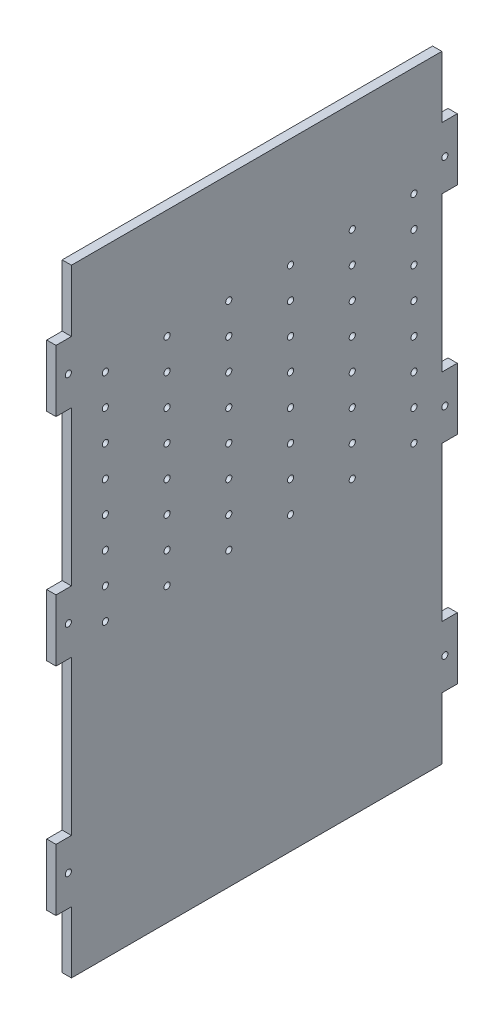
from build123d import *

# Parameters (mm, degrees)
SKETCH1_R           = 1
BOSS_EXTRUDE1_DEPTH = 3


with BuildPart() as part:
    # Sketch1 → Boss-Extrude1 (new body)
    with BuildSketch(Plane.YZ):
        Polygon((-80, 60), (-80, 65), (-60, 65), (-60, 60), (-10, 60), (-10, 65), (10, 65), (10, 60), (60, 60), (60, 65), (80, 65), (80, 60), (100, 60), (100, -60), (80, -60), (80, -65), (60, -65), (60, -60), (10, -60), (10, -65), (-10, -65), (-10, -60), (-60, -60), (-60, -65), (-80, -65), (-80, -60), (-100, -60), (-100, 60), align=None)
        with Locations(Location((-5.445919919, 49.018671667, 0), (0, 0, 270))):
            Circle(SKETCH1_R, mode=Mode.SUBTRACT)
        with Locations(Location((4.554080081, 49.018671667, 0), (0, 0, 270))):
            Circle(SKETCH1_R, mode=Mode.SUBTRACT)
        with Locations(Location((14.554080081, 49.018671667, 0), (0, 0, 270))):
            Circle(SKETCH1_R, mode=Mode.SUBTRACT)
        with Locations(Location((24.554080081, 49.018671667, 0), (0, 0, 270))):
            Circle(SKETCH1_R, mode=Mode.SUBTRACT)
        with Locations(Location((34.554080081, 49.018671667, 0), (0, 0, 270))):
            Circle(SKETCH1_R, mode=Mode.SUBTRACT)
        with Locations(Location((44.554080081, 49.018671667, 0), (0, 0, 270))):
            Circle(SKETCH1_R, mode=Mode.SUBTRACT)
        with Locations(Location((54.554080081, 49.018671667, 0), (0, 0, 270))):
            Circle(SKETCH1_R, mode=Mode.SUBTRACT)
        with Locations(Location((64.554080081, 49.018671667, 0), (0, 0, 270))):
            Circle(SKETCH1_R, mode=Mode.SUBTRACT)
        with Locations(Location((-5.445919919, 29.018671667, 0), (0, 0, 270))):
            Circle(SKETCH1_R, mode=Mode.SUBTRACT)
        with Locations(Location((4.554080081, 29.018671667, 0), (0, 0, 270))):
            Circle(SKETCH1_R, mode=Mode.SUBTRACT)
        with Locations(Location((14.554080081, 29.018671667, 0), (0, 0, 270))):
            Circle(SKETCH1_R, mode=Mode.SUBTRACT)
        with Locations(Location((24.554080081, 29.018671667, 0), (0, 0, 270))):
            Circle(SKETCH1_R, mode=Mode.SUBTRACT)
        with Locations(Location((34.554080081, 29.018671667, 0), (0, 0, 270))):
            Circle(SKETCH1_R, mode=Mode.SUBTRACT)
        with Locations(Location((44.554080081, 29.018671667, 0), (0, 0, 270))):
            Circle(SKETCH1_R, mode=Mode.SUBTRACT)
        with Locations(Location((54.554080081, 29.018671667, 0), (0, 0, 270))):
            Circle(SKETCH1_R, mode=Mode.SUBTRACT)
        with Locations(Location((64.554080081, 29.018671667, 0), (0, 0, 270))):
            Circle(SKETCH1_R, mode=Mode.SUBTRACT)
        with Locations(Location((-5.445919919, 9.018671667, 0), (0, 0, 270))):
            Circle(SKETCH1_R, mode=Mode.SUBTRACT)
        with Locations(Location((4.554080081, 9.018671667, 0), (0, 0, 270))):
            Circle(SKETCH1_R, mode=Mode.SUBTRACT)
        with Locations(Location((14.554080081, 9.018671667, 0), (0, 0, 270))):
            Circle(SKETCH1_R, mode=Mode.SUBTRACT)
        with Locations(Location((24.554080081, 9.018671667, 0), (0, 0, 270))):
            Circle(SKETCH1_R, mode=Mode.SUBTRACT)
        with Locations(Location((34.554080081, 9.018671667, 0), (0, 0, 270))):
            Circle(SKETCH1_R, mode=Mode.SUBTRACT)
        with Locations(Location((44.554080081, 9.018671667, 0), (0, 0, 270))):
            Circle(SKETCH1_R, mode=Mode.SUBTRACT)
        with Locations(Location((54.554080081, 9.018671667, 0), (0, 0, 270))):
            Circle(SKETCH1_R, mode=Mode.SUBTRACT)
        with Locations(Location((64.554080081, 9.018671667, 0), (0, 0, 270))):
            Circle(SKETCH1_R, mode=Mode.SUBTRACT)
        with Locations(Location((-5.445919919, -10.981328333, 0), (0, 0, 270))):
            Circle(SKETCH1_R, mode=Mode.SUBTRACT)
        with Locations(Location((4.554080081, -10.981328333, 0), (0, 0, 270))):
            Circle(SKETCH1_R, mode=Mode.SUBTRACT)
        with Locations(Location((14.554080081, -10.981328333, 0), (0, 0, 270))):
            Circle(SKETCH1_R, mode=Mode.SUBTRACT)
        with Locations(Location((24.554080081, -10.981328333, 0), (0, 0, 270))):
            Circle(SKETCH1_R, mode=Mode.SUBTRACT)
        with Locations(Location((34.554080081, -10.981328333, 0), (0, 0, 270))):
            Circle(SKETCH1_R, mode=Mode.SUBTRACT)
        with Locations(Location((44.554080081, -10.981328333, 0), (0, 0, 270))):
            Circle(SKETCH1_R, mode=Mode.SUBTRACT)
        with Locations(Location((54.554080081, -10.981328333, 0), (0, 0, 270))):
            Circle(SKETCH1_R, mode=Mode.SUBTRACT)
        with Locations(Location((64.554080081, -10.981328333, 0), (0, 0, 270))):
            Circle(SKETCH1_R, mode=Mode.SUBTRACT)
        with Locations(Location((-5.445919919, -30.981328333, 0), (0, 0, 270))):
            Circle(SKETCH1_R, mode=Mode.SUBTRACT)
        with Locations(Location((4.554080081, -30.981328333, 0), (0, 0, 270))):
            Circle(SKETCH1_R, mode=Mode.SUBTRACT)
        with Locations(Location((14.554080081, -30.981328333, 0), (0, 0, 270))):
            Circle(SKETCH1_R, mode=Mode.SUBTRACT)
        with Locations(Location((24.554080081, -30.981328333, 0), (0, 0, 270))):
            Circle(SKETCH1_R, mode=Mode.SUBTRACT)
        with Locations(Location((34.554080081, -30.981328333, 0), (0, 0, 270))):
            Circle(SKETCH1_R, mode=Mode.SUBTRACT)
        with Locations(Location((44.554080081, -30.981328333, 0), (0, 0, 270))):
            Circle(SKETCH1_R, mode=Mode.SUBTRACT)
        with Locations(Location((54.554080081, -30.981328333, 0), (0, 0, 270))):
            Circle(SKETCH1_R, mode=Mode.SUBTRACT)
        with Locations(Location((64.554080081, -30.981328333, 0), (0, 0, 270))):
            Circle(SKETCH1_R, mode=Mode.SUBTRACT)
        with Locations(Location((-5.445919919, -50.981328333, 0), (0, 0, 270))):
            Circle(SKETCH1_R, mode=Mode.SUBTRACT)
        with Locations(Location((4.554080081, -50.981328333, 0), (0, 0, 270))):
            Circle(SKETCH1_R, mode=Mode.SUBTRACT)
        with Locations(Location((14.554080081, -50.981328333, 0), (0, 0, 270))):
            Circle(SKETCH1_R, mode=Mode.SUBTRACT)
        with Locations(Location((24.554080081, -50.981328333, 0), (0, 0, 270))):
            Circle(SKETCH1_R, mode=Mode.SUBTRACT)
        with Locations(Location((34.554080081, -50.981328333, 0), (0, 0, 270))):
            Circle(SKETCH1_R, mode=Mode.SUBTRACT)
        with Locations(Location((44.554080081, -50.981328333, 0), (0, 0, 270))):
            Circle(SKETCH1_R, mode=Mode.SUBTRACT)
        with Locations(Location((54.554080081, -50.981328333, 0), (0, 0, 270))):
            Circle(SKETCH1_R, mode=Mode.SUBTRACT)
        with Locations(Location((64.554080081, -50.981328333, 0), (0, 0, 270))):
            Circle(SKETCH1_R, mode=Mode.SUBTRACT)
        with Locations(Location((-70, 61, 0), (0, 0, 270))):
            Circle(SKETCH1_R, mode=Mode.SUBTRACT)
        with Locations(Location((70, 61, 0), (0, 0, 270))):
            Circle(SKETCH1_R, mode=Mode.SUBTRACT)
        with Locations(Location((0, 61, 0), (0, 0, 270))):
            Circle(SKETCH1_R, mode=Mode.SUBTRACT)
        with Locations(Location((70, -61, 0), (0, 0, 270))):
            Circle(SKETCH1_R, mode=Mode.SUBTRACT)
        with Locations(Location((0, -61, 0), (0, 0, 270))):
            Circle(SKETCH1_R, mode=Mode.SUBTRACT)
        with Locations(Location((-70, -61, 0), (0, 0, 270))):
            Circle(SKETCH1_R, mode=Mode.SUBTRACT)
    extrude(amount=BOSS_EXTRUDE1_DEPTH)


solid = part.part
